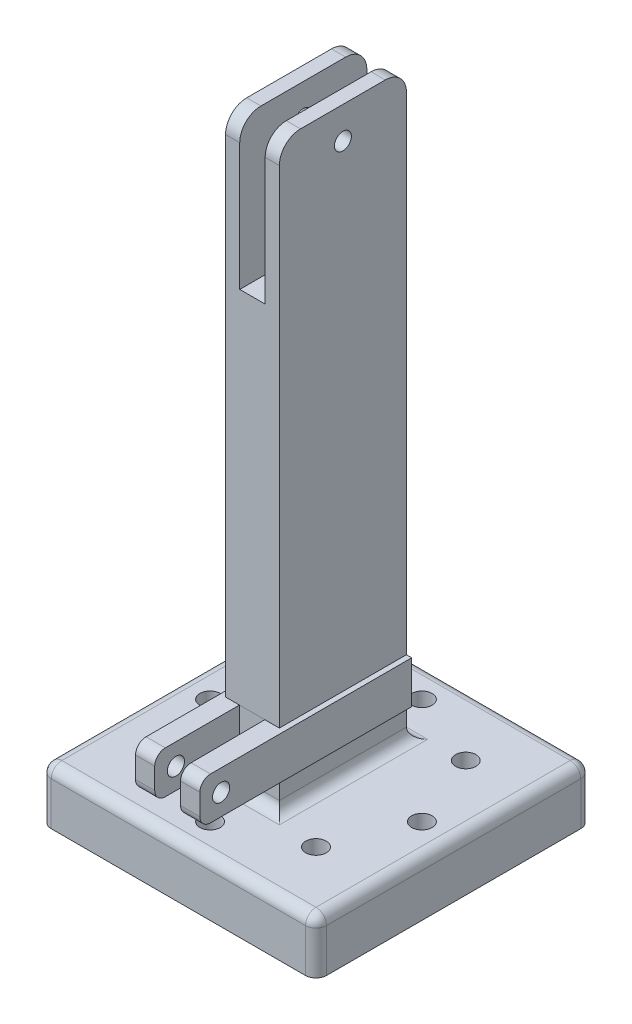
from build123d import *

# Parameters (mm, degrees)
SKETCH1_W               = 65
SKETCH1_H               = 65
BOSS_EXTRUDE1_DEPTH     = 12.7
SKETCH2_R               = 2
BOSS_EXTRUDE2_DEPTH     = 6.35
FILLET1_R               = 2.5
CUT_EXTRUDE2_DEPTH      = 157.883714897
CUT_EXTRUDE2_DEPTH_BACK = 12.7
SKETCH3_R               = 2.413
SKETCH4_R               = 2.032
BOSS_EXTRUDE4_DEPTH     = 7.6
CUT_EXTRUDE3_DEPTH      = 12.45
SKETCH6_W               = 6
SKETCH6_H               = 30
SKETCH6_H_2             = 5
CUT_EXTRUDE4_DEPTH      = 161.662690131


with BuildPart() as part:
    # Sketch1 → Boss-Extrude1 (new body)
    with BuildSketch(Plane(origin=(0, 0, 0), x_dir=(1, 0, 0), z_dir=(0, 1, 0))):
        Rectangle(SKETCH1_W, SKETCH1_H)
    extrude(amount=BOSS_EXTRUDE1_DEPTH)

    # Sketch2 → Boss-Extrude2 (add, symmetric)
    with BuildSketch(Plane(origin=(0, 0, 0), x_dir=(0, 0, -1), z_dir=(1, 0, 0))):
        with BuildLine():
            Line((-15, 0), (15, 0))
            Line((15, 0), (15, 145))
            ThreePointArc((15, 145), (13.535533906, 148.535533906), (10, 150))
            Line((10, 150), (-10, 150))
            ThreePointArc((-10, 150), (-13.535533906, 148.535533906), (-15, 145))
            Line((-15, 145), (-15, 0))
        make_face()
        with Locations((0, 142.5)):
            Circle(SKETCH2_R, mode=Mode.SUBTRACT)
    extrude(amount=BOSS_EXTRUDE2_DEPTH, both=True)

    # Fillet1
    fillet1_edges = [part.edges().sort_by_distance(p)[0] for p in [
        (32.5, 12.7, 0),
        (0, 12.7, -32.5),
        (-6.35, 12.7, 0),
        (0, 12.7, 15),
        (0, 12.7, -15),
        (6.35, 12.7, 0),
        (-32.5, 12.7, 0),
        (-32.5, 6.35, -32.5),
        (32.5, 6.35, -32.5),
        (32.5, 6.35, 32.5),
        (-32.5, 6.35, 32.5),
        (0, 12.7, 32.5),
    ]]
    fillet(fillet1_edges, radius=FILLET1_R)

    # Sketch3 → Cut-Extrude2 (cut, two sides: drawn at the far end of the back side and taken through both)
    with BuildSketch(Plane(origin=(0, 0, 0), x_dir=(1, 0, 0), z_dir=(0, 1, 0)).offset(-CUT_EXTRUDE2_DEPTH_BACK)):
        with Locations(Location((17.67766953, -17.67766953, 0), (0, 0, 270))):
            Circle(SKETCH3_R)
        with Locations(Location((25, 0, 0), (0, 0, 270))):
            Circle(SKETCH3_R)
        with Locations(Location((17.67766953, 17.67766953, 0), (0, 0, 270))):
            Circle(SKETCH3_R)
        with Locations(Location((0, 25, 0), (0, 0, 270))):
            Circle(SKETCH3_R)
        with Locations(Location((-17.67766953, 17.67766953, 0), (0, 0, 270))):
            Circle(SKETCH3_R)
        with Locations(Location((-25, 0, 0), (0, 0, 270))):
            Circle(SKETCH3_R)
        with Locations(Location((-17.67766953, -17.67766953, 0), (0, 0, 270))):
            Circle(SKETCH3_R)
        with Locations(Location((0, -25, 0), (0, 0, 270))):
            Circle(SKETCH3_R)
    extrude(amount=CUT_EXTRUDE2_DEPTH + CUT_EXTRUDE2_DEPTH_BACK, mode=Mode.SUBTRACT)

    # Sketch4 → Boss-Extrude4 (add, symmetric)
    with BuildSketch(Plane(origin=(0, 0, 0), x_dir=(0, 0, -1), z_dir=(1, 0, 0))):
        with BuildLine():
            Line((15, 20), (-32.5, 20))
            ThreePointArc((-32.5, 20), (-34.267766953, 20.732233047), (-35, 22.5))
            Line((-35, 22.5), (-35, 27.5))
            ThreePointArc((-35, 27.5), (-34.267766953, 29.267766953), (-32.5, 30))
            Line((-32.5, 30), (15, 30))
            Line((15, 30), (15, 20))
        make_face()
        with Locations(Location((-30, 25, 0), (0, 0, 180))):
            Circle(SKETCH4_R, mode=Mode.SUBTRACT)
    extrude(amount=BOSS_EXTRUDE4_DEPTH, both=True)

    # Sketch5 → Cut-Extrude3 (cut)
    with BuildSketch(Plane(origin=(0, 30, 0), x_dir=(1, 0, 0), z_dir=(0, 1, 0))):
        Polygon((-3.070505438, -14.989300838), (-3.070505438, -44.384490964), (3.070505438, -44.384490964), (2.929494562, -14.989300838), align=None)
    extrude(amount=-CUT_EXTRUDE3_DEPTH, mode=Mode.SUBTRACT)

    # Sketch6 → Cut-Extrude4 (cut, through all)
    with BuildSketch(Plane.XY.offset(15)):
        with Locations((0, 130)):
            Rectangle(SKETCH6_W, SKETCH6_H)
        with Locations((0, 147.5)):
            Rectangle(SKETCH6_W, SKETCH6_H_2)
    extrude(amount=-CUT_EXTRUDE4_DEPTH, mode=Mode.SUBTRACT)


solid = part.part
